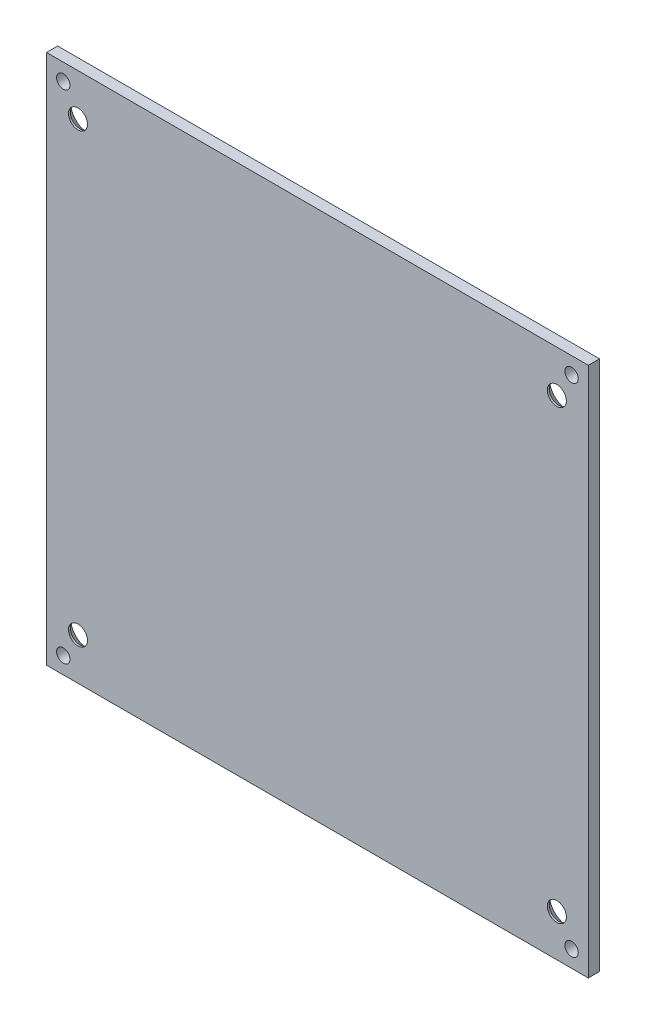
from build123d import *

# Parameters (mm, degrees)
PLATE_SKETCH_W                 = 97
PLATE_SKETCH_H                 = 95
PLATE_DEPTH                    = 2
M2_FOOT_SCREW_HOLES_DEPTH      = 136.786597277
M2_FOOT_SCREW_HOLES_DEPTH_BACK = 136.786597277
M2_FOOT_SCREW_HOLES_SKETCH_R   = 1.2
M3_STACK_ROD_HOLES_DEPTH       = 136.786597277
M3_STACK_ROD_HOLES_DEPTH_BACK  = 136.786597277
M3_STACK_ROD_HOLES_SKETCH_R    = 1.7
M3_COUNTERSINKS_SIZE           = 1.66


with BuildPart() as part:
    # Plate sketch → Plate (new body)
    with BuildSketch(Plane.XY):
        with Locations((48.5, 47.5)):
            Rectangle(PLATE_SKETCH_W, PLATE_SKETCH_H)
    extrude(amount=PLATE_DEPTH)

    # M2 foot screw holes sketch → M2 foot screw holes (cut, two sides: drawn at the far end of the back side and taken through both)
    with BuildSketch(Plane.XY.offset(-M2_FOOT_SCREW_HOLES_DEPTH_BACK)):
        with Locations((3, 3)):
            Circle(M2_FOOT_SCREW_HOLES_SKETCH_R)
        with Locations((94, 3)):
            Circle(M2_FOOT_SCREW_HOLES_SKETCH_R)
        with Locations((3, 92)):
            Circle(M2_FOOT_SCREW_HOLES_SKETCH_R)
        with Locations((94, 92)):
            Circle(M2_FOOT_SCREW_HOLES_SKETCH_R)
    extrude(amount=M2_FOOT_SCREW_HOLES_DEPTH + M2_FOOT_SCREW_HOLES_DEPTH_BACK, mode=Mode.SUBTRACT)

    # M3 stack rod holes sketch → M3 stack rod holes (cut, two sides: drawn at the far end of the back side and taken through both)
    with BuildSketch(Plane.XY.offset(-M3_STACK_ROD_HOLES_DEPTH_BACK)):
        with Locations((5.635, 7.495)):
            Circle(M3_STACK_ROD_HOLES_SKETCH_R)
        with Locations((91.365, 7.495)):
            Circle(M3_STACK_ROD_HOLES_SKETCH_R)
        with Locations((5.635, 87.505)):
            Circle(M3_STACK_ROD_HOLES_SKETCH_R)
        with Locations((91.365, 87.505)):
            Circle(M3_STACK_ROD_HOLES_SKETCH_R)
    extrude(amount=M3_STACK_ROD_HOLES_DEPTH + M3_STACK_ROD_HOLES_DEPTH_BACK, mode=Mode.SUBTRACT)

    # M3 countersinks
    m3_countersinks_edges = [part.edges().sort_by_distance(p)[0] for p in [
        (89.665, 7.495, 0),
        (3.935, 87.505, 0),
        (89.665, 87.505, 0),
        (3.935, 7.495, 0),
    ]]
    chamfer(m3_countersinks_edges, length=M3_COUNTERSINKS_SIZE)


solid = part.part
